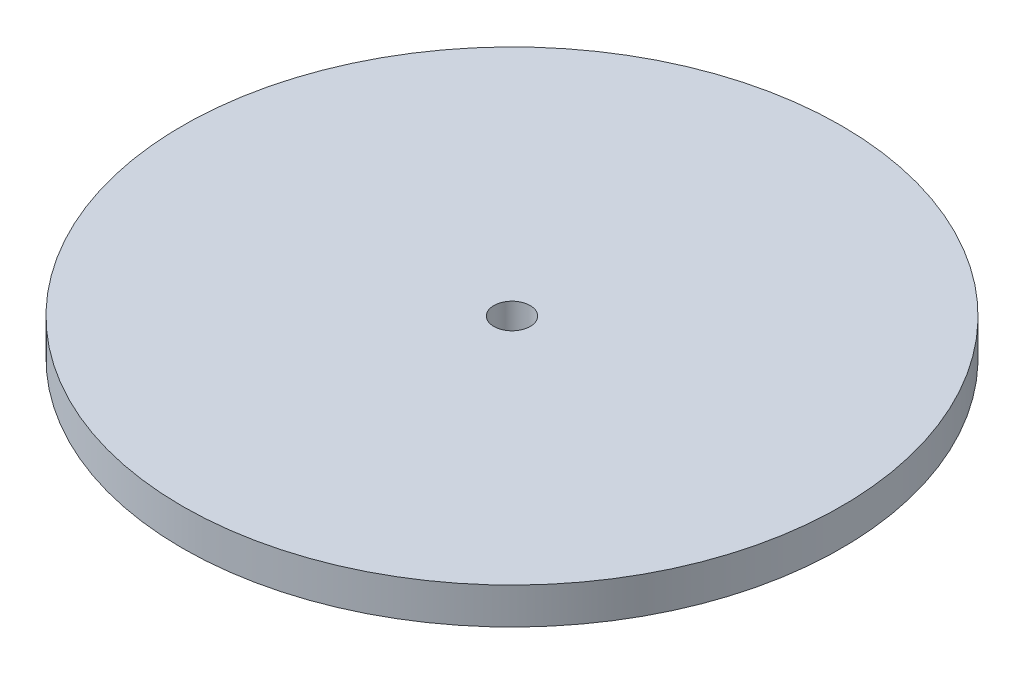
from build123d import *

# Parameters (mm, degrees)
SKETCH1_R           = 36.25
SKETCH1_R_2         = 2
BOSS_EXTRUDE1_DEPTH = 4


with BuildPart() as part:
    # Sketch1 → Boss-Extrude1 (new body)
    with BuildSketch(Plane(origin=(0, 0, 0), x_dir=(1, 0, 0), z_dir=(0, 1, 0))):
        with Locations(Location((0, 0, 0), (0, 0, 270))):
            Circle(SKETCH1_R)
        with Locations(Location((0, 0, 0), (0, 0, 270))):
            Circle(SKETCH1_R_2, mode=Mode.SUBTRACT)
    extrude(amount=BOSS_EXTRUDE1_DEPTH)


solid = part.part
